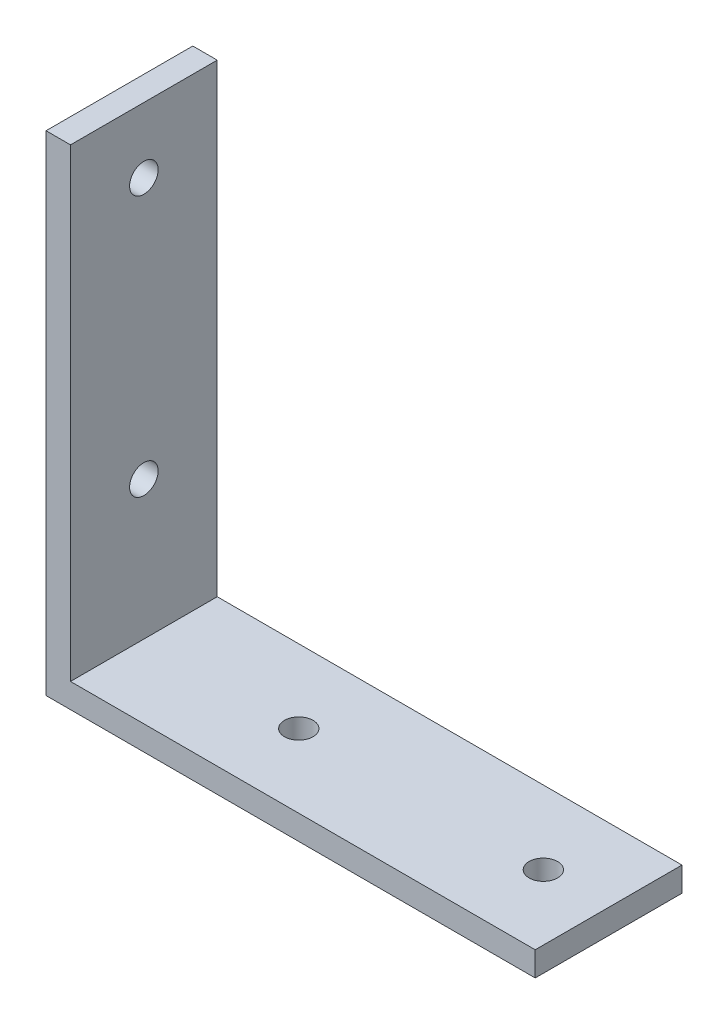
from build123d import *

# Parameters (mm, degrees)
EXTRUDE_1_DEPTH     = 18
SKETCH_3_R          = 1.75
CUT_EXTRUDE_1_DEPTH = 79.31347266
SKETCH_4_R          = 1.75
CUT_EXTRUDE_3_DEPTH = 79.31347266


with BuildPart() as part:
    # 草图2 → 凸台-拉伸1 (new body)
    with BuildSketch(Plane.XY):
        Polygon((0, 0), (60, 0), (60, 3), (3, 3), (3, 60), (0, 60), align=None)
    extrude(amount=EXTRUDE_1_DEPTH)

    # 草图3 → 切除-拉伸1 (cut, through all)
    with BuildSketch(Plane(origin=(13, 0, 0), x_dir=(0, 0, -1), z_dir=(1, 0, 0))):
        with Locations(Location((-9, 52, 0), (0, 0, 90))):
            Circle(SKETCH_3_R)
        with Locations(Location((-9, 20, 0), (0, 0, 90))):
            Circle(SKETCH_3_R)
    extrude(amount=-CUT_EXTRUDE_1_DEPTH, mode=Mode.SUBTRACT)

    # 草图4 → 切除-拉伸3 (cut, through all)
    with BuildSketch(Plane(origin=(0, 13, 0), x_dir=(1, 0, 0), z_dir=(0, 1, 0))):
        with Locations(Location((52, -9, 0), (0, 0, 180))):
            Circle(SKETCH_4_R)
        with Locations(Location((22, -9, 0), (0, 0, 180))):
            Circle(SKETCH_4_R)
    extrude(amount=-CUT_EXTRUDE_3_DEPTH, mode=Mode.SUBTRACT)


solid = part.part
